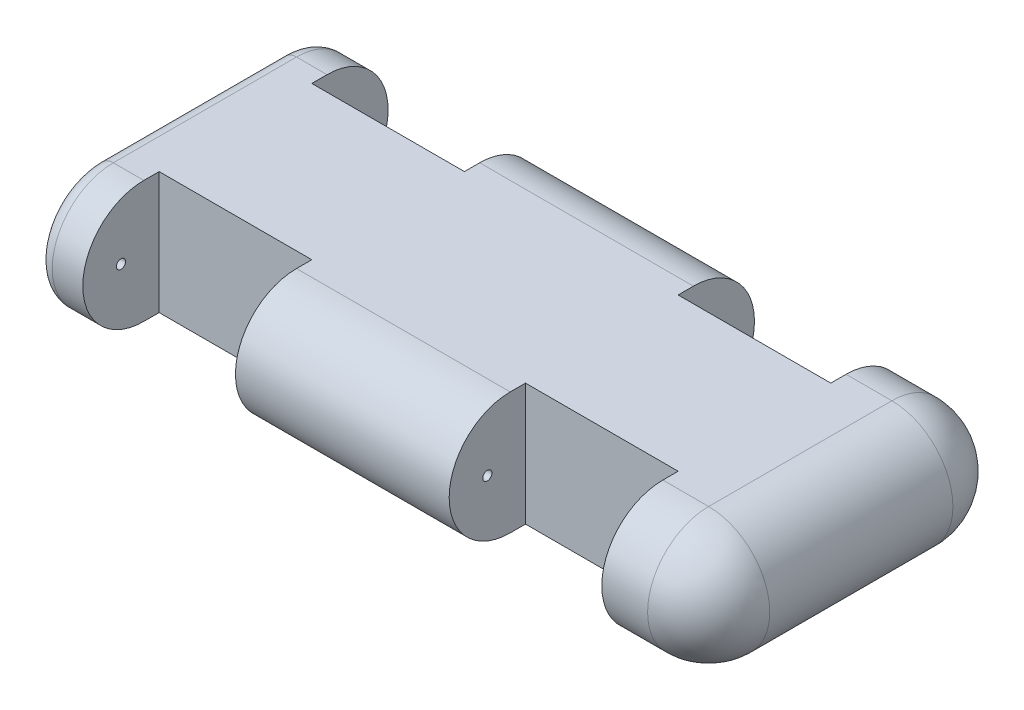
from build123d import *

# Parameters (mm, degrees)
BOSS_EXTRUDE1_DEPTH     = 40
CUT_EXTRUDE1_DEPTH      = 291.688837075
CUT_EXTRUDE1_DEPTH_BACK = 291.688837075
SKETCH2_R               = 3
CUT_EXTRUDE2_DEPTH      = 291.688837075
CUT_EXTRUDE2_DEPTH_BACK = 291.688837075
SKETCH3_R               = 3
CUT_EXTRUDE3_DEPTH      = 415.246303544
CUT_EXTRUDE3_DEPTH_BACK = 415.246303544
CUT_EXTRUDE4_DEPTH      = 415.246303544
CUT_EXTRUDE4_DEPTH_BACK = 415.246303544
BOSS_EXTRUDE3_DEPTH     = 60
REVOLVE1_ANGLE          = 90
FILLET1_R               = 10


with BuildPart() as part:
    # Sketch1 → Boss-Extrude1 (new, symmetric)
    with BuildSketch(Plane(origin=(0, 0, 0), x_dir=(1, 0, 0), z_dir=(0, 1, 0))):
        Polygon((-200, 100), (-170, 100), (-170, 50), (-70, 50), (-70, 100), (70, 100), (70, 50), (170, 50), (170, 100), (200, 100), (200, -100), (170, -100), (170, -50), (70, -50), (70, -100), (-70, -100), (-70, -50), (-170, -50), (-170, -100), (-200, -100), align=None)
    extrude(amount=BOSS_EXTRUDE1_DEPTH, both=True)

    # Sketch2 → Cut-Extrude1 (cut, two sides: drawn at the far end of the back side and taken through both)
    with BuildSketch(Plane.ZY.offset(70).offset(-CUT_EXTRUDE1_DEPTH_BACK)):
        with Locations((-75, 0)):
            Circle(SKETCH2_R)
    extrude(amount=CUT_EXTRUDE1_DEPTH + CUT_EXTRUDE1_DEPTH_BACK, mode=Mode.SUBTRACT)

    # Sketch3 → Cut-Extrude2 (cut, two sides: drawn at the far end of the back side and taken through both)
    with BuildSketch(Plane.ZY.offset(70).offset(-CUT_EXTRUDE2_DEPTH_BACK)):
        with Locations((75, 0)):
            Circle(SKETCH3_R)
    extrude(amount=CUT_EXTRUDE2_DEPTH + CUT_EXTRUDE2_DEPTH_BACK, mode=Mode.SUBTRACT)

    # Sketch4 → Cut-Extrude3 (cut, two sides: drawn at the far end of the back side and taken through both)
    with BuildSketch(Plane.ZY.offset(200).offset(-CUT_EXTRUDE3_DEPTH_BACK)):
        with BuildLine():
            Line((-60, -40), (-60, -70.289993794))
            Line((-60, -70.289993794), (-136.864216991, -70.289993794))
            Line((-136.864216991, -70.289993794), (-136.864216991, 63.942219024))
            Line((-136.864216991, 63.942219024), (-60, 63.942219024))
            Line((-60, 63.942219024), (-60, 40))
            ThreePointArc((-60, 40), (-100, 0), (-60, -40))
        make_face()
    extrude(amount=CUT_EXTRUDE3_DEPTH + CUT_EXTRUDE3_DEPTH_BACK, mode=Mode.SUBTRACT)

    # Sketch5 → Cut-Extrude4 (cut, two sides: drawn at the far end of the back side and taken through both)
    with BuildSketch(Plane.ZY.offset(200).offset(-CUT_EXTRUDE4_DEPTH_BACK)):
        with BuildLine():
            Line((60, -40), (60, -76.328121014))
            Line((60, -76.328121014), (141.05428579, -76.328121014))
            Line((141.05428579, -76.328121014), (141.05428579, 68.89657982))
            Line((141.05428579, 68.89657982), (60, 68.89657982))
            Line((60, 68.89657982), (60, 40))
            ThreePointArc((60, 40), (100, 0), (60, -40))
        make_face()
    extrude(amount=CUT_EXTRUDE4_DEPTH + CUT_EXTRUDE4_DEPTH_BACK, mode=Mode.SUBTRACT)

    # Sketch7 → Boss-Extrude3 (add, symmetric)
    with BuildSketch(Plane.XY):
        with BuildLine():
            Line((200, 40), (200, -40))
            ThreePointArc((200, -40), (240, 0), (200, 40))
        make_face()
    extrude(amount=BOSS_EXTRUDE3_DEPTH, both=True)

    # Sketch8 → Revolve1 (revolve)
    with BuildSketch(Plane.XY.offset(60)):
        with BuildLine():
            Line((200, 40), (200, -40))
            ThreePointArc((200, -40), (240, 0), (200, 40))
        make_face()
    revolve1 = revolve(axis=Axis((200, 40, 60), (0, -1, 0)), revolution_arc=REVOLVE1_ANGLE)

    # Mirror1: Revolve1 across plane
    add(revolve1.mirror(Plane.XY))

    # Fillet1
    fillet1_edges = [part.edges().sort_by_distance(p)[0] for p in [
        (-200, 0, 100),
        (-200, -40, 0),
        (-200, 40, 0),
        (-200, 0, -100),
    ]]
    fillet(fillet1_edges, radius=FILLET1_R)


solid = part.part
